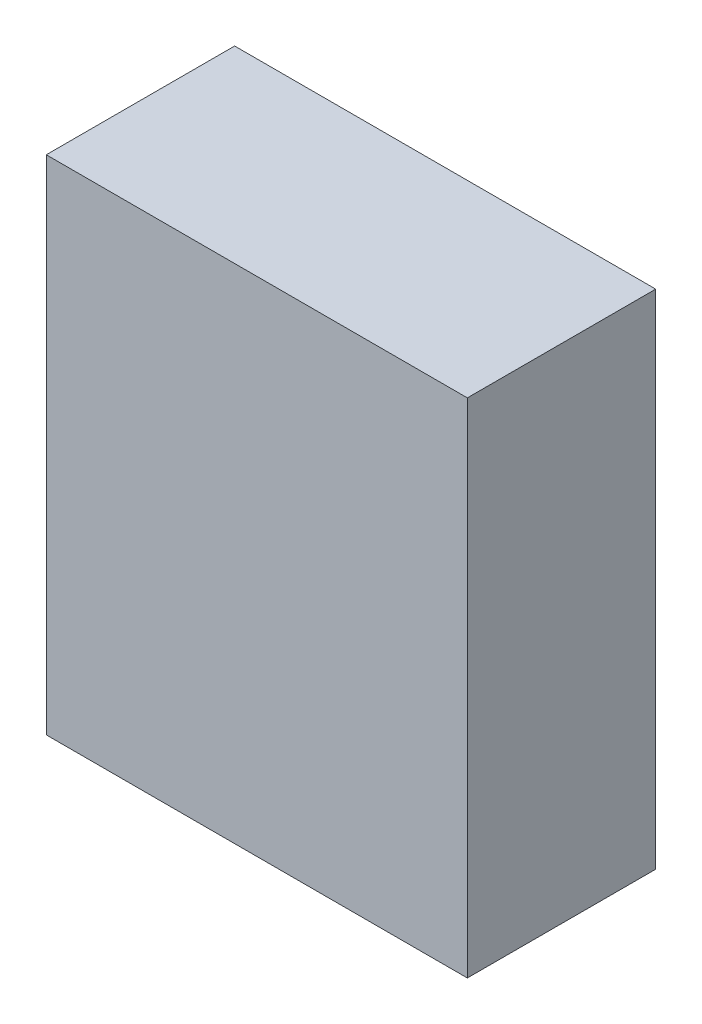
from build123d import *

# Parameters (mm, degrees)
SKETCH1_W               = 2.2352
SKETCH1_H               = 2.667
COMPONENT_OUTLINE_DEPTH = 1


with BuildPart() as part:
    # Sketch1 → Component_Outline (new body)
    with BuildSketch(Plane.XY):
        with Locations((0, -0.0889)):
            Rectangle(SKETCH1_W, SKETCH1_H)
    extrude(amount=COMPONENT_OUTLINE_DEPTH)


solid = part.part
